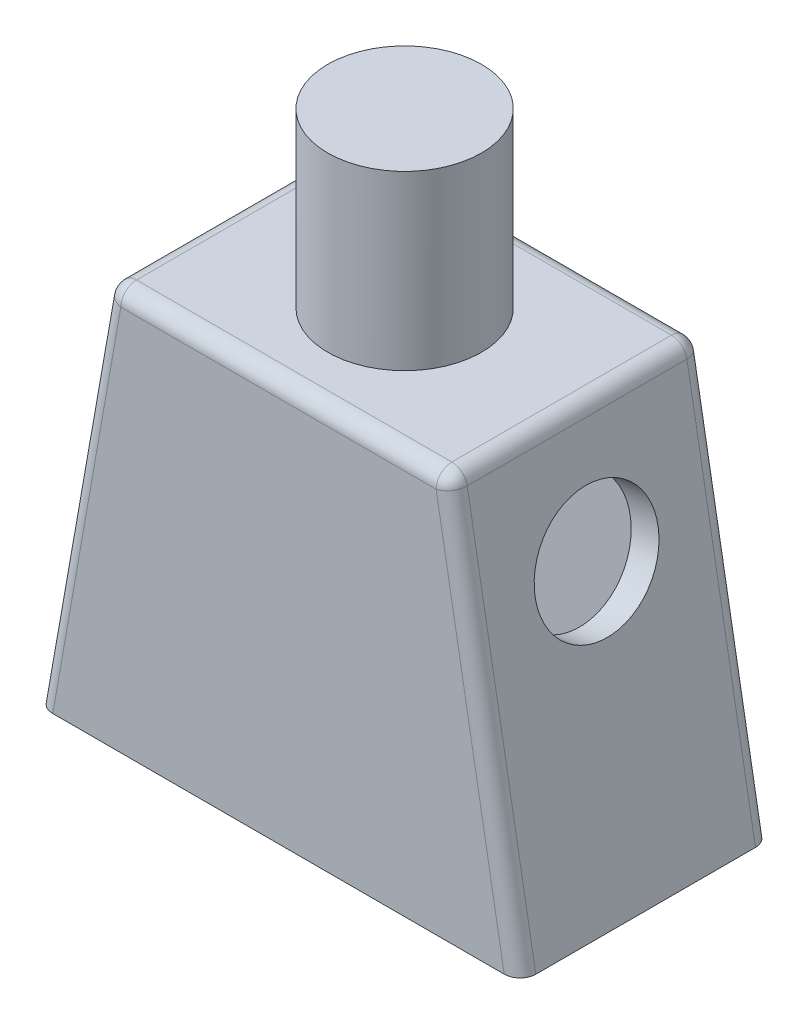
from build123d import *

# Parameters (mm, degrees)
BOSS_EXTRUDE1_DEPTH = 8
CUT_EXTRUDE3_START  = -1.5
CUT_EXTRUDE3_DEPTH  = 5
SKETCH2_R           = 1.96
CUT_EXTRUDE1_DEPTH  = 0.9
SKETCH3_R           = 2
CUT_EXTRUDE2_DEPTH  = 0.9
FILLET1_R           = 0.5
SKETCH4_R           = 2.45
BOSS_EXTRUDE2_DEPTH = 5.5


with BuildPart() as part:
    # Sketch1 → Boss-Extrude1 (new body)
    with BuildSketch(Plane.XY):
        Polygon((0, 0), (15.4, 0), (13.143014647, 12.8), (2.256985353, 12.8), align=None)
    extrude(amount=BOSS_EXTRUDE1_DEPTH)

    # Sketch5 → Cut-Extrude3 (cut)
    with BuildSketch(Plane.XY.offset(8).offset(CUT_EXTRUDE3_START)):
        Polygon((1.178374422, 0), (1.178374422, 1.5), (3.012175021, 11.9), (12.387824979, 11.9), (14.221625578, 1.5), (14.221625578, 0), align=None)
    extrude(amount=-CUT_EXTRUDE3_DEPTH, mode=Mode.SUBTRACT)

    # Sketch2 → Cut-Extrude1 (cut)
    with BuildSketch(Plane(origin=(14.93563318, 2.633555104, 0), x_dir=(0, 0, -1), z_dir=(0.9848077530122086, 0.17364817766692736, 0))):
        with Locations(Location((-4, 6.325818064, 0), (0, 0, 90))):
            Circle(SKETCH2_R)
    extrude(amount=-CUT_EXTRUDE1_DEPTH, mode=Mode.SUBTRACT)

    # Sketch3 → Cut-Extrude2 (cut)
    with BuildSketch(Plane(origin=(0, 0, 0), x_dir=(0, 0, 1), z_dir=(-0.9848077530122087, 0.17364817766692736, 0))):
        with Locations(Location((4, 9, 0), (0, 0, 270))):
            Circle(SKETCH3_R)
    extrude(amount=-CUT_EXTRUDE2_DEPTH, mode=Mode.SUBTRACT)

    # Fillet1
    fillet1_edges = [part.edges().sort_by_distance(p)[0] for p in [
        (14.271507323, 6.4, 8),
        (7.7, 12.8, 8),
        (1.128492677, 6.4, 8),
        (7.7, 12.8, 0),
        (14.271507323, 6.4, 0),
        (1.128492677, 6.4, 0),
        (2.256985353, 12.8, 4),
        (13.143014647, 12.8, 4),
    ]]
    fillet(fillet1_edges, radius=FILLET1_R)

    # Sketch4 → Boss-Extrude2 (add)
    with BuildSketch(Plane(origin=(0, 12.8, 0), x_dir=(1, 0, 0), z_dir=(0, 1, 0))):
        with Locations(Location((7.72, -4, 0), (0, 0, 90))):
            Circle(SKETCH4_R)
    extrude(amount=BOSS_EXTRUDE2_DEPTH)


solid = part.part
